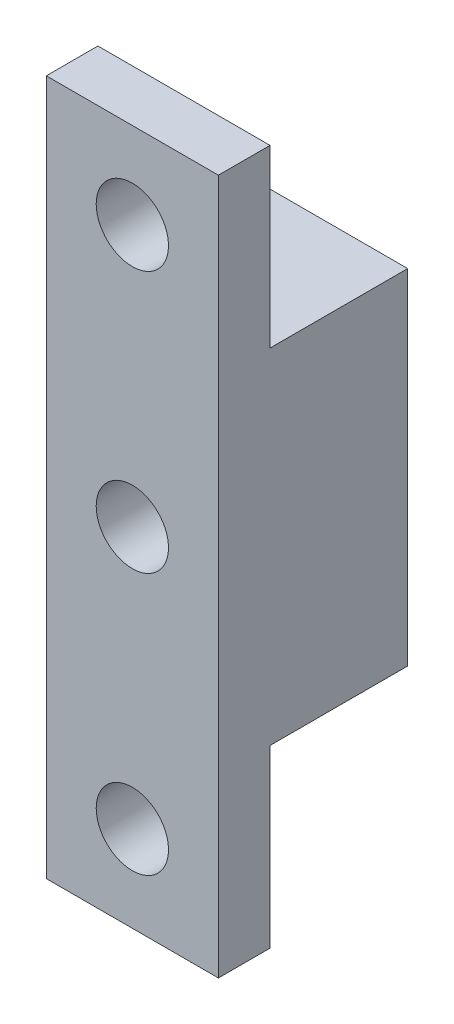
from build123d import *

# Parameters (mm, degrees)
CROQUIS1_W              = 10
CROQUIS1_H              = 10
CROQUIS1_H_2            = 20.4
CROQUIS1_R              = 2.1
SALIENTE_EXTRUIR1_DEPTH = 3
CROQUIS2_W              = 5
CROQUIS2_H              = 20
SALIENTE_EXTRUIR2_DEPTH = 8
CORTAR_EXTRUIR1_DEPTH   = 4
CROQUIS4_R              = 2.1
CORTAR_EXTRUIR2_DEPTH   = 185.05302625


with BuildPart() as part:
    # Croquis1 → Saliente-Extruir1 (new body)
    # profile 1 of 6: a face of its own
    with BuildSketch(Plane(origin=(0, 0, -124.398862982), x_dir=(-1, 0, 0), z_dir=(0, 0, -1))):
        with Locations((-5, 178.647805519)):
            Rectangle(CROQUIS1_W, CROQUIS1_H)
        with BuildLine():
            ThreePointArc((-7.522554348, 176.84593994), (-7.904499228, 177.217722585), (-8.39233871, 177.432470964))
            ThreePointArc((-8.39233871, 177.432470964), (-9.35, 178.647805519), (-8.39233871, 179.863140073))
            ThreePointArc((-8.39233871, 179.863140073), (-7.904499228, 180.077888452), (-7.522554348, 180.449671097))
            ThreePointArc((-7.522554348, 180.449671097), (-1.9, 178.647805519), (-7.522554348, 176.84593994))
        make_face(mode=Mode.SUBTRACT)
    # profile 2 of 6: a face of its own
    with BuildSketch(Plane(origin=(0, 0, -124.398862982), x_dir=(-1, 0, 0), z_dir=(0, 0, -1))):
        with Locations((-5, 163.447805519)):
            Rectangle(CROQUIS1_W, CROQUIS1_H_2)
    # profile 3 of 6: a face of its own
    with BuildSketch(Plane(origin=(0, 0, -124.398862982), x_dir=(-1, 0, 0), z_dir=(0, 0, -1))):
        with Locations((-5, 148.247805519)):
            Rectangle(CROQUIS1_W, CROQUIS1_H)
        with BuildLine():
            ThreePointArc((-1.9, 148.247805519), (-4.053934061, 145.295694538), (-7.522554348, 146.44593994))
            ThreePointArc((-7.522554348, 146.44593994), (-8.1, 148.247805519), (-7.522554348, 150.049671097))
            ThreePointArc((-7.522554348, 150.049671097), (-4.053934061, 151.199916499), (-1.9, 148.247805519))
        make_face(mode=Mode.SUBTRACT)
    # profile 4 of 6: a face of its own
    with BuildSketch(Plane(origin=(0, 0, -124.398862982), x_dir=(-1, 0, 0), z_dir=(0, 0, -1))):
        with BuildLine():
            ThreePointArc((-7.522554348, 150.049671097), (-8.1, 148.247805519), (-7.522554348, 146.44593994))
            ThreePointArc((-7.522554348, 146.44593994), (-4.053934061, 145.295694538), (-1.9, 148.247805519))
            ThreePointArc((-1.9, 148.247805519), (-4.053934061, 151.199916499), (-7.522554348, 150.049671097))
        make_face()
        with Locations((-5, 148.247805519)):
            Circle(CROQUIS1_R, mode=Mode.SUBTRACT)
    # profile 5 of 6: a face of its own
    with BuildSketch(Plane(origin=(0, 0, -124.398862982), x_dir=(-1, 0, 0), z_dir=(0, 0, -1))):
        with BuildLine():
            ThreePointArc((-7.522554348, 180.449671097), (-8.1, 178.647805519), (-7.522554348, 176.84593994))
            ThreePointArc((-7.522554348, 176.84593994), (-4.053934061, 175.695694538), (-1.9, 178.647805519))
            ThreePointArc((-1.9, 178.647805519), (-4.053934061, 181.599916499), (-7.522554348, 180.449671097))
        make_face()
        with Locations((-5, 178.647805519)):
            Circle(CROQUIS1_R, mode=Mode.SUBTRACT)
    # profile 6 of 6: a face of its own
    with BuildSketch(Plane(origin=(0, 0, -124.398862982), x_dir=(-1, 0, 0), z_dir=(0, 0, -1))):
        with BuildLine():
            ThreePointArc((-8.39233871, 177.432470964), (-7.904499228, 177.217722585), (-7.522554348, 176.84593994))
            ThreePointArc((-7.522554348, 176.84593994), (-8.1, 178.647805519), (-7.522554348, 180.449671097))
            ThreePointArc((-7.522554348, 180.449671097), (-7.904499228, 180.077888452), (-8.39233871, 179.863140073))
            ThreePointArc((-8.39233871, 179.863140073), (-9.35, 178.647805519), (-8.39233871, 177.432470964))
        make_face()
    extrude(amount=SALIENTE_EXTRUIR1_DEPTH)

    # Croquis2 → Saliente-Extruir2 (add)
    with BuildSketch(Plane(origin=(0, 0, -127.398862982), x_dir=(-1, 0, 0), z_dir=(0, 0, -1))):
        with Locations((-2.5, 163.447805519)):
            Rectangle(CROQUIS2_W, CROQUIS2_H)
        with Locations((-7.5, 163.447805519)):
            Rectangle(CROQUIS2_W, CROQUIS2_H)
    extrude(amount=SALIENTE_EXTRUIR2_DEPTH)

    # Croquis3 → Cortar-Extruir1 (cut)
    with BuildSketch(Plane(origin=(0, 0, -135.398862982), x_dir=(-1, 0, 0), z_dir=(0, 0, -1))):
        with BuildLine():
            ThreePointArc((-1.9, 163.447805519), (-2.807968978, 165.63983654), (-5, 166.547805519))
            Line((-5, 166.547805519), (-5, 160.347805519))
            ThreePointArc((-5, 160.347805519), (-2.807968978, 161.255774497), (-1.9, 163.447805519))
        make_face()
        with BuildLine():
            Line((-5, 160.347805519), (-5, 166.547805519))
            ThreePointArc((-5, 166.547805519), (-8.1, 163.447805519), (-5, 160.347805519))
        make_face()
    extrude(amount=-CORTAR_EXTRUIR1_DEPTH, mode=Mode.SUBTRACT)

    # Croquis4 → Cortar-Extruir2 (cut, through all)
    with BuildSketch(Plane(origin=(0, 0, -131.398862982), x_dir=(-1, 0, 0), z_dir=(0, 0, -1))):
        with Locations((-5, 163.447805519)):
            Circle(CROQUIS4_R)
    extrude(amount=-CORTAR_EXTRUIR2_DEPTH, mode=Mode.SUBTRACT)


solid = part.part
